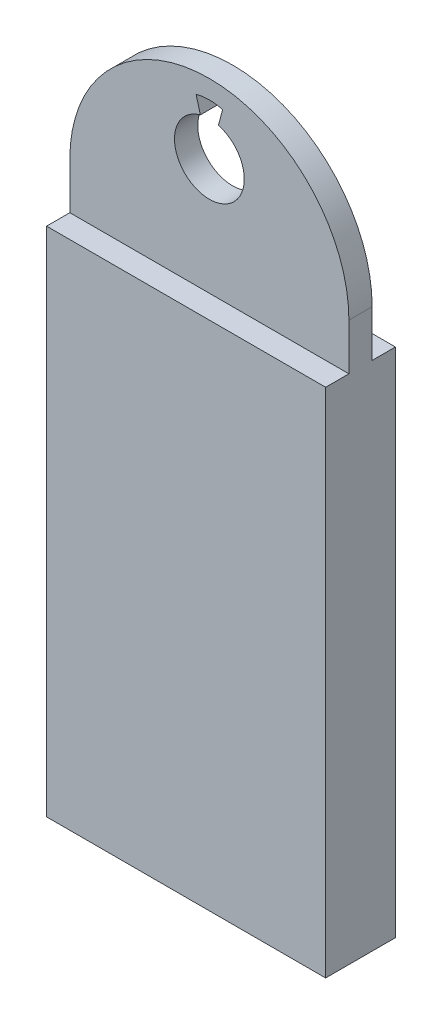
from build123d import *

# Parameters (mm, degrees)
SKETCH_1_W          = 120
SKETCH_1_H          = 240
EXTRUDE_1_DEPTH     = 30
SKETCH_6_W          = 120
SKETCH_6_H          = 10
CUT_EXTRUDE_2_DEPTH = 20
EXTRUDE_4_DEPTH     = 10
CUT_EXTRUDE_3_DEPTH = 327.763219646


with BuildPart() as part:
    # 草图1 → 凸台-拉伸1 (new body)
    with BuildSketch(Plane.XY):
        with Locations((-67.961719718, 120)):
            Rectangle(SKETCH_1_W, SKETCH_1_H)
    extrude(amount=EXTRUDE_1_DEPTH)

    # 草图6 → 切除-拉伸2 (cut)
    with BuildSketch(Plane(origin=(0, 240, 0), x_dir=(1, 0, 0), z_dir=(0, 1, 0))):
        with Locations((-67.961719718, -5)):
            Rectangle(SKETCH_6_W, SKETCH_6_H)
        with Locations((-67.961719718, -25)):
            Rectangle(SKETCH_6_W, SKETCH_6_H)
    extrude(amount=-CUT_EXTRUDE_2_DEPTH, mode=Mode.SUBTRACT)

    # 草图7 → 凸台-拉伸4 (add)
    with BuildSketch(Plane.XY.offset(20)):
        with BuildLine():
            ThreePointArc((-7.961719718, 240), (-67.961719718, 300), (-127.961719718, 240))
            Line((-127.961719718, 240), (-7.961719718, 240))
        make_face()
        with BuildLine():
            Line((-7.961719718, 240), (-127.961719718, 240))
            ThreePointArc((-127.961719718, 240), (-67.961719718, 180), (-7.961719718, 240))
        make_face()
    extrude(amount=-EXTRUDE_4_DEPTH)

    # 草图8 → 切除-拉伸3 (cut, through all)
    with BuildSketch(Plane.XY.offset(20)):
        with BuildLine():
            ThreePointArc((-62.267700726, 291.250368178), (-67.961719718, 292), (-73.65573871, 291.250368178))
            Line((-73.65573871, 291.250368178), (-71.844005395, 284.488887394))
            ThreePointArc((-71.844005395, 284.488887394), (-67.961719718, 285), (-64.079434042, 284.488887394))
            Line((-64.079434042, 284.488887394), (-62.267700726, 291.250368178))
        make_face()
        with BuildLine():
            Line((-71.844005395, 284.488887394), (-67.961719718, 270))
            Line((-67.961719718, 270), (-64.079434042, 284.488887394))
            ThreePointArc((-64.079434042, 284.488887394), (-67.961719718, 285), (-71.844005395, 284.488887394))
        make_face()
        with BuildLine():
            Line((-67.961719718, 270), (-67.961719718, 255))
            ThreePointArc((-67.961719718, 255), (-57.355118, 259.393398282), (-52.961719718, 270))
            ThreePointArc((-52.961719718, 270), (-56.061419614, 279.131421435), (-64.079434042, 284.488887394))
            Line((-64.079434042, 284.488887394), (-67.961719718, 270))
        make_face()
        with BuildLine():
            ThreePointArc((-71.844005395, 284.488887394), (-82.833392639, 268.042107117), (-67.961719718, 255))
            Line((-67.961719718, 255), (-67.961719718, 270))
            Line((-67.961719718, 270), (-71.844005395, 284.488887394))
        make_face()
    extrude(amount=-CUT_EXTRUDE_3_DEPTH, mode=Mode.SUBTRACT)


solid = part.part
